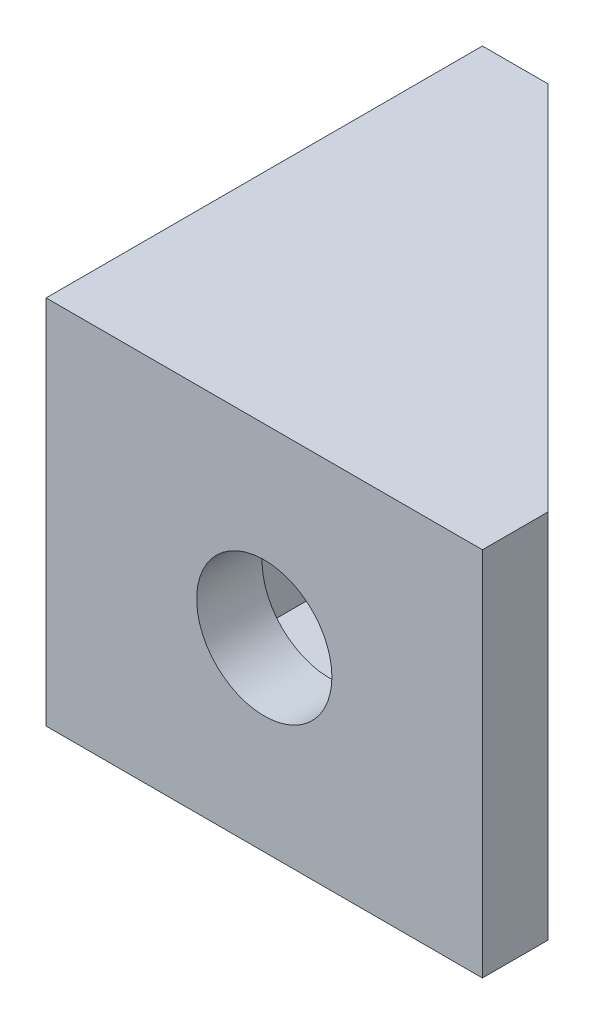
from build123d import *

# Parameters (mm, degrees)
SKETCH1_W           = 20
SKETCH1_H           = 20
BOSS_EXTRUDE1_DEPTH = 17
CUT_EXTRUDE1_DEPTH  = 17
SKETCH3_W           = 17
SKETCH3_H           = 13
CUT_EXTRUDE2_DEPTH  = 17
CUT_EXTRUDE3_REACH  = 35
SKETCH4_R           = 3.1
CUT_EXTRUDE4_REACH  = 35
SKETCH5_R           = 3.1


with BuildPart() as part:
    # Sketch1 → Boss-Extrude1 (new body)
    with BuildSketch(Plane(origin=(0, 0, 0), x_dir=(1, 0, 0), z_dir=(0, 1, 0))):
        with Locations((10, 10)):
            Rectangle(SKETCH1_W, SKETCH1_H)
    extrude(amount=BOSS_EXTRUDE1_DEPTH)

    # Sketch2 → Cut-Extrude1 (cut)
    with BuildSketch(Plane(origin=(0, 17, 0), x_dir=(1, 0, 0), z_dir=(0, 1, 0))):
        Polygon((3, 20), (20, 3), (20, 20), align=None)
    extrude(amount=-CUT_EXTRUDE1_DEPTH, mode=Mode.SUBTRACT)

    # Sketch3 → Cut-Extrude2 (cut)
    with BuildSketch(Plane(origin=(0, 0, -20), x_dir=(-1, 0, 0), z_dir=(0, 0, -1))):
        with Locations((-11.5, 8.5)):
            Rectangle(SKETCH3_W, SKETCH3_H)
    extrude(amount=-CUT_EXTRUDE2_DEPTH, mode=Mode.SUBTRACT)

    # Sketch4 → Cut-Extrude3 (cut, up to next)
    with BuildSketch(Plane.ZY, mode=Mode.PRIVATE) as cut_extrude3_sk1:
        with Locations((-10, 8.5)):
            Circle(SKETCH4_R)
    cut_extrude3_tool1 = extrude(cut_extrude3_sk1.sketch, amount=-CUT_EXTRUDE3_REACH, mode=Mode.PRIVATE) & part.part
    add(cut_extrude3_tool1.solids().sort_by_distance((0, 8.5, -10))[0], mode=Mode.SUBTRACT)

    # Sketch5 → Cut-Extrude4 (cut, up to next)
    with BuildSketch(Plane.XY, mode=Mode.PRIVATE) as cut_extrude4_sk1:
        with Locations((10, 8.5)):
            Circle(SKETCH5_R)
    cut_extrude4_tool1 = extrude(cut_extrude4_sk1.sketch, amount=-CUT_EXTRUDE4_REACH, mode=Mode.PRIVATE) & part.part
    add(cut_extrude4_tool1.solids().sort_by_distance((10, 8.5, 0))[0], mode=Mode.SUBTRACT)


solid = part.part
